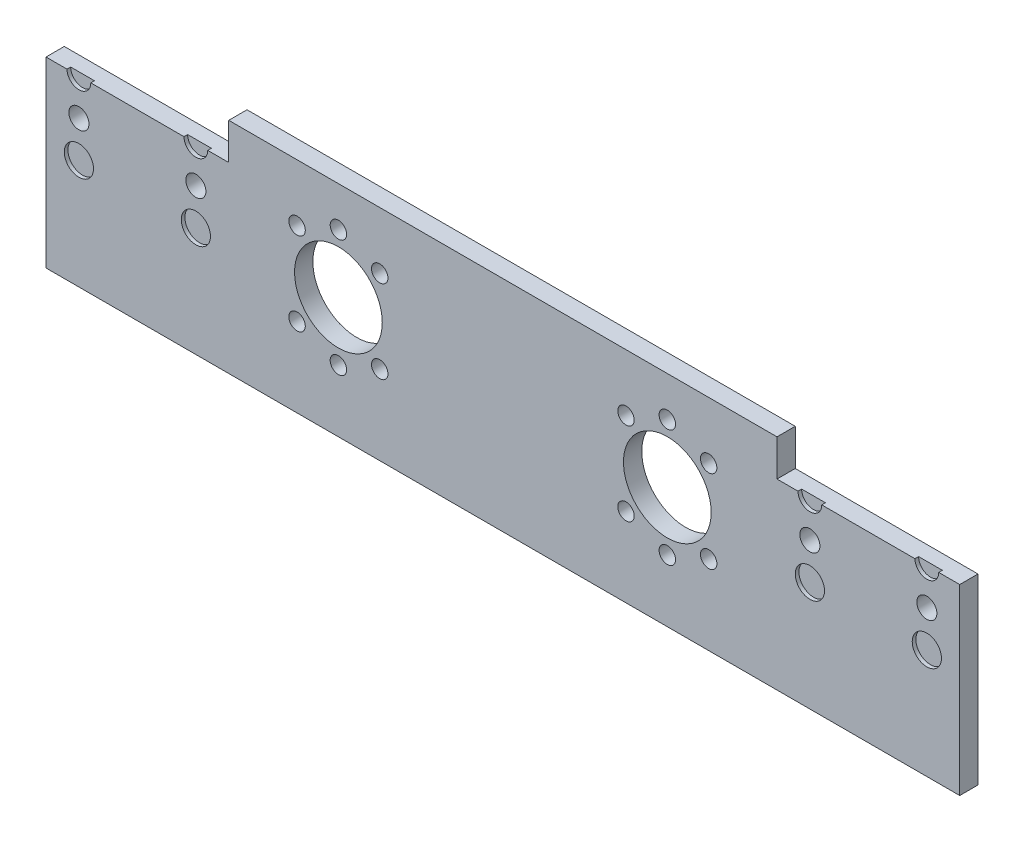
from build123d import *

# Parameters (mm, degrees)
SKETCH_1_W          = 290
SKETCH_1_H          = 50
EXTRUDE_1_DEPTH     = 5
SKETCH_3_W          = 20
SKETCH_3_H          = 50
CUT_EXTRUDE_1_DEPTH = 10
SKETCH_4_W          = 150
SKETCH_4_H          = 5
EXTRUDE_2_DEPTH     = 10
SKETCH_2_R          = 2.25
SKETCH_2_R_2        = 12
CUT_EXTRUDE_2_DEPTH = 2.5
SKETCH_2_2_R        = 2.25
CUT_EXTRUDE_3_DEPTH = 130.903810568
SKETCH_5_R          = 2.75
CUT_EXTRUDE_4_DEPTH = 130.903810568
SKETCH_2_3_R        = 12
CUT_EXTRUDE_5_DEPTH = 10
SKETCH_6_R          = 3.25
SKETCH_6_R_2        = 4
CUT_EXTRUDE_6_DEPTH = 1


with BuildPart() as part:
    # 스케치1 → 보스-돌출1 (new body)
    with BuildSketch(Plane.XY):
        Rectangle(SKETCH_1_W, SKETCH_1_H)
    extrude(amount=EXTRUDE_1_DEPTH)

    # 스케치3 → 컷-돌출1 (cut)
    with BuildSketch(Plane.XY.offset(5)):
        with Locations((-135, 0)):
            Rectangle(SKETCH_3_W, SKETCH_3_H)
    cut_extrude_1 = extrude(amount=-CUT_EXTRUDE_1_DEPTH, mode=Mode.SUBTRACT)

    # 대칭 복사1: 컷-돌출1 across plane
    add(cut_extrude_1.mirror(Plane(origin=(0, 0, 0), x_dir=(0, 0, 1), z_dir=(1, 0, 0))), mode=Mode.SUBTRACT)

    # 스케치4 → 보스-돌출2 (add)
    with BuildSketch(Plane(origin=(0, 25, 0), x_dir=(1, 0, 0), z_dir=(0, 1, 0))):
        with Locations((0, -2.5)):
            Rectangle(SKETCH_4_W, SKETCH_4_H)
    extrude(amount=EXTRUDE_2_DEPTH)

    # 스케치2 → 컷-돌출2 (cut)
    with BuildSketch(Plane.XY.offset(5)):
        with Locations((56.308011299, -3.31)):
            Circle(SKETCH_2_R)
        with Locations((33.69, -3.31)):
            Circle(SKETCH_2_R)
        with Locations((44.99900565, -8)):
            Circle(SKETCH_2_R)
        with Locations((56.308011299, 19.4)):
            Circle(SKETCH_2_R)
        with Locations((44.99900565, 24.09)):
            Circle(SKETCH_2_R)
        with Locations((33.69, 19.4)):
            Circle(SKETCH_2_R)
        with Locations((-33.69, 19.4)):
            Circle(SKETCH_2_R)
        with Locations((-44.99900565, 24.09)):
            Circle(SKETCH_2_R)
        with Locations((-56.308011299, 19.4)):
            Circle(SKETCH_2_R)
        with Locations((-44.99900565, -8)):
            Circle(SKETCH_2_R)
        with Locations((-33.69, -3.31)):
            Circle(SKETCH_2_R)
        with Locations((-56.308011299, -3.31)):
            Circle(SKETCH_2_R)
        with Locations((44.99900565, 8.045)):
            Circle(SKETCH_2_R_2)
    extrude(amount=-CUT_EXTRUDE_2_DEPTH, mode=Mode.SUBTRACT)

    # 스케치2<2> → 컷-돌출3 (cut, through all)
    with BuildSketch(Plane.XY.offset(5)):
        with Locations((56.308011299, -3.31)):
            Circle(SKETCH_2_2_R)
        with Locations((33.69, -3.31)):
            Circle(SKETCH_2_2_R)
        with Locations((44.99900565, -8)):
            Circle(SKETCH_2_2_R)
        with Locations((56.308011299, 19.4)):
            Circle(SKETCH_2_2_R)
        with Locations((44.99900565, 24.09)):
            Circle(SKETCH_2_2_R)
        with Locations((33.69, 19.4)):
            Circle(SKETCH_2_2_R)
        with Locations((-33.69, 19.4)):
            Circle(SKETCH_2_2_R)
        with Locations((-44.99900565, 24.09)):
            Circle(SKETCH_2_2_R)
        with Locations((-56.308011299, 19.4)):
            Circle(SKETCH_2_2_R)
        with Locations((-44.99900565, -8)):
            Circle(SKETCH_2_2_R)
        with Locations((-33.69, -3.31)):
            Circle(SKETCH_2_2_R)
        with Locations((-56.308011299, -3.31)):
            Circle(SKETCH_2_2_R)
    extrude(amount=-CUT_EXTRUDE_3_DEPTH, mode=Mode.SUBTRACT)

    # 스케치5 → 컷-돌출4 (cut, through all)
    with BuildSketch(Plane.XY.offset(5)):
        with Locations((-84, 15)):
            Circle(SKETCH_5_R)
        with Locations((-116, 15)):
            Circle(SKETCH_5_R)
        with Locations((116, 15)):
            Circle(SKETCH_5_R)
        with Locations((84, 15)):
            Circle(SKETCH_5_R)
    extrude(amount=-CUT_EXTRUDE_4_DEPTH, mode=Mode.SUBTRACT)

    # 스케치2<3> → 컷-돌출5 (cut)
    with BuildSketch(Plane.XY.offset(5)):
        with Locations((44.99900565, 8.045)):
            Circle(SKETCH_2_3_R)
    cut_extrude_5 = extrude(amount=-CUT_EXTRUDE_5_DEPTH, mode=Mode.SUBTRACT)

    # 대칭 복사2: 컷-돌출5 across plane
    add(cut_extrude_5.mirror(Plane(origin=(0, 0, 0), x_dir=(0, 0, 1), z_dir=(1, 0, 0))), mode=Mode.SUBTRACT)

    # 스케치6 → 컷-돌출6 (cut)
    with BuildSketch(Plane.XY.offset(5)):
        with Locations((-116, 25)):
            Circle(SKETCH_6_R)
        with Locations((-84, 25)):
            Circle(SKETCH_6_R)
        with Locations((84, 25)):
            Circle(SKETCH_6_R)
        with Locations((116, 25)):
            Circle(SKETCH_6_R)
        with Locations((-116, 5)):
            Circle(SKETCH_6_R_2)
        with Locations((-84, 5)):
            Circle(SKETCH_6_R_2)
        with Locations((84, 5)):
            Circle(SKETCH_6_R_2)
        with Locations((116, 5)):
            Circle(SKETCH_6_R_2)
    extrude(amount=-CUT_EXTRUDE_6_DEPTH, mode=Mode.SUBTRACT)


solid = part.part
